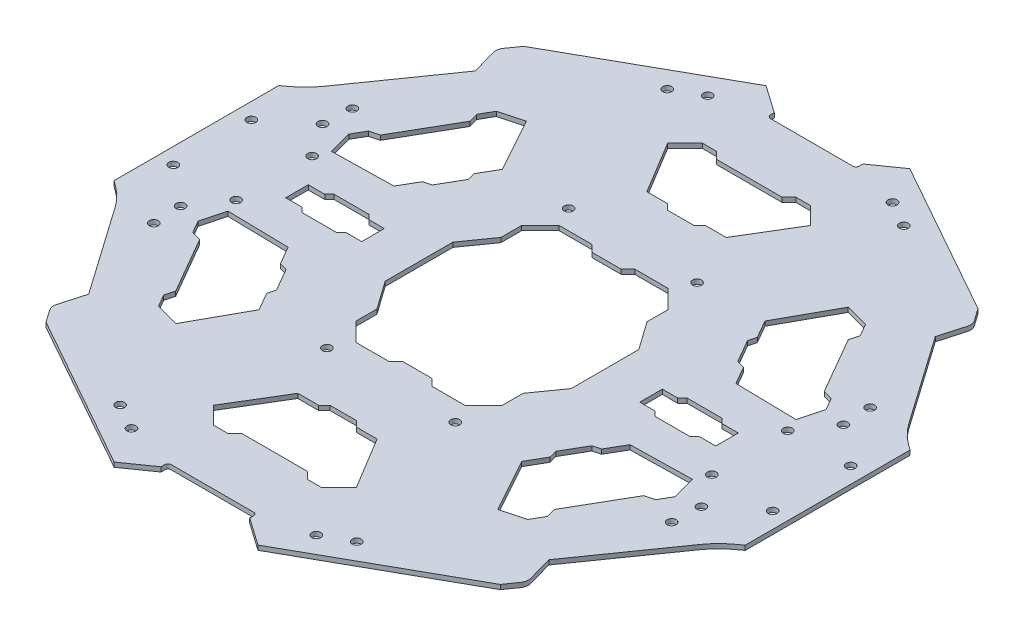
from build123d import *

# Parameters (mm, degrees)
CUT_EXTRUDE1_DEPTH      = 140.098801485
CIRPATTERN1_COUNT       = 6
CUT_EXTRUDE2_DEPTH      = 140.098801485
CUT_EXTRUDE2_DEPTH_BACK = 140.098801485
SKETCH5_R               = 1.37451171
CUT_EXTRUDE3_DEPTH      = 140.098801485
SKETCH4_R               = 1.37451171
CUT_EXTRUDE4_DEPTH      = 140.098801485
SKETCH7_R               = 1.37451171
CUT_EXTRUDE5_DEPTH      = 140.098801485
SKETCH8_R               = 1.37451171
CUT_EXTRUDE6_DEPTH      = 140.098801485
SKETCH9_R               = 1.37451171
CUT_EXTRUDE7_DEPTH      = 140.098801485
SKETCH10_R              = 1.374511707
CUT_EXTRUDE8_DEPTH      = 140.098801485
CUT_EXTRUDE9_DEPTH      = 140.098801485
SKETCH11_R              = 1.37451171
CUT_EXTRUDE10_DEPTH     = 140.098801485
MIRROR3_COPY_1_SKETCH_R = 1.37451171
MIRROR3_COPY_1_DEPTH    = 140.098801485
MIRROR3_COPY_2_SKETCH_R = 1.37451171
MIRROR3_COPY_2_DEPTH    = 140.098801485
MIRROR3_COPY_3_SKETCH_R = 1.37451171
MIRROR3_COPY_3_DEPTH    = 140.098801485
MIRROR3_COPY_4_SKETCH_R = 1.37451171
MIRROR3_COPY_4_DEPTH    = 140.098801485
MIRROR3_COPY_5_SKETCH_R = 1.37451171
MIRROR3_COPY_5_DEPTH    = 140.098801485
MIRROR3_COPY_6_SKETCH_R = 1.374511707
MIRROR3_COPY_6_DEPTH    = 140.098801485
MIRROR3_COPY_7_SKETCH_R = 1.37451171
MIRROR3_COPY_7_DEPTH    = 140.098801485


with BuildPart() as part:
    # Sketch13 for Loft1 → Loft1 section 0
    with BuildSketch(Plane(origin=(0, 1.4, 0), x_dir=(1, 0, 0), z_dir=(0, 1, 0))):
        with BuildLine():
            Line((12.599851657, 91.857709774), (-12.599851657, 91.857709774))
            # circular arc as an exact rational Bezier (weights 1, cos(half-angle), 1)
            Bezier((-12.599851657, 91.857709774), (-13.599851657, 91.857709774), (-13.599851657, 92.857709774), weights=[1, 0.707106781, 1])
            Line((-13.599851657, 92.857709774), (-13.599851657, 93.998402185))
            Line((-13.599851657, 93.998402185), (-22.036698219, 99.916787086))
            Line((-22.036698219, 99.916787086), (-69.635623594, 73.22109349))
            Line((-69.635623594, 73.22109349), (-72.26426252, 69.473884808))
            Bezier((-72.26426252, 69.473884808), (-73.083449495, 68.306107631), (-72.694781967, 66.933625067), weights=[1, 0.903107805, 1])
            Line((-72.694781967, 66.933625067), (-70.517085175, 59.243631276))
            Line((-70.517085175, 59.243631276), (-89.654844676, 31.962144329))
            Bezier((-89.654844676, 31.962144329), (-91.865667397, 28.810545981), (-94.982261121, 26.550644917), weights=[1, 0.986279769, 1])
            Line((-94.982261121, 26.550644917), (-96.763382502, 25.259120111))
            Line((-96.763382502, 25.259120111), (-96.763382502, -25.259120111))
            Line((-96.763382502, -25.259120111), (-94.982261121, -26.550644917))
            Bezier((-94.982261121, -26.550644917), (-91.865667397, -28.810545981), (-89.654844676, -31.962144329), weights=[1, 0.986279769, 1])
            Line((-89.654844676, -31.962144329), (-70.517085175, -59.243631276))
            Line((-70.517085175, -59.243631276), (-72.694781967, -66.933625067))
            Bezier((-72.694781967, -66.933625067), (-73.083449495, -68.306107631), (-72.26426252, -69.473884808), weights=[1, 0.903107805, 1])
            Line((-72.26426252, -69.473884808), (-69.635623594, -73.22109349))
            Line((-69.635623594, -73.22109349), (-22.036698219, -99.916787086))
            Line((-22.036698219, -99.916787086), (-13.599851657, -93.998402185))
            Line((-13.599851657, -93.998402185), (-13.599851657, -92.857709774))
            Bezier((-13.599851657, -92.857709774), (-13.599851657, -91.857709774), (-12.599851657, -91.857709774), weights=[1, 0.707106781, 1])
            Line((-12.599851657, -91.857709774), (12.599851657, -91.857709774))
            Bezier((12.599851657, -91.857709774), (13.599851657, -91.857709774), (13.599851657, -92.857709774), weights=[1, 0.707106781, 1])
            Line((13.599851657, -92.857709774), (13.599851657, -93.998402185))
            Line((13.599851657, -93.998402185), (22.036698219, -99.916787086))
            Line((22.036698219, -99.916787086), (69.635623594, -73.22109349))
            Line((69.635623594, -73.22109349), (72.26426252, -69.473884808))
            Bezier((72.26426252, -69.473884808), (73.083449495, -68.306107631), (72.694781967, -66.933625067), weights=[1, 0.903107805, 1])
            Line((72.694781967, -66.933625067), (70.517085175, -59.243631276))
            Line((70.517085175, -59.243631276), (89.654844676, -31.962144329))
            Bezier((89.654844676, -31.962144329), (91.865667397, -28.810545981), (94.982261121, -26.550644917), weights=[1, 0.986279769, 1])
            Line((94.982261121, -26.550644917), (96.763382502, -25.259120111))
            Line((96.763382502, -25.259120111), (96.763382502, 25.259120111))
            Line((96.763382502, 25.259120111), (94.982261121, 26.550644917))
            Bezier((94.982261121, 26.550644917), (91.865667397, 28.810545981), (89.654844676, 31.962144329), weights=[1, 0.986279769, 1])
            Line((89.654844676, 31.962144329), (70.517085175, 59.243631276))
            Line((70.517085175, 59.243631276), (72.694781967, 66.933625067))
            Bezier((72.694781967, 66.933625067), (73.083449495, 68.306107631), (72.26426252, 69.473884808), weights=[1, 0.903107805, 1])
            Line((72.26426252, 69.473884808), (69.635623594, 73.22109349))
            Line((69.635623594, 73.22109349), (22.036698219, 99.916787086))
            Line((22.036698219, 99.916787086), (13.599851657, 93.998402185))
            Line((13.599851657, 93.998402185), (13.599851657, 92.857709774))
            Bezier((13.599851657, 92.857709774), (13.599851657, 91.857709774), (12.599851657, 91.857709774), weights=[1, 0.707106781, 1])
        make_face()
    # Sketch2 for Loft1 → Loft1 section 1
    with BuildSketch(Plane(origin=(0, 0, 0), x_dir=(1, 0, 0), z_dir=(0, 1, 0))):
        with BuildLine():
            Line((12.599851657, 91.857709774), (-12.599851657, 91.857709774))
            Bezier((-12.599851657, 91.857709774), (-13.599851657, 91.857709774), (-13.599851657, 92.857709774), weights=[1, 0.707106781, 1])
            Line((-13.599851657, 92.857709774), (-13.599851657, 93.998402185))
            Line((-13.599851657, 93.998402185), (-22.036698219, 99.916787086))
            Line((-22.036698219, 99.916787086), (-69.635623594, 73.22109349))
            Line((-69.635623594, 73.22109349), (-72.26426252, 69.473884808))
            Bezier((-72.26426252, 69.473884808), (-73.083449495, 68.306107631), (-72.694781967, 66.933625067), weights=[1, 0.903107805, 1])
            Line((-72.694781967, 66.933625067), (-70.517085175, 59.243631276))
            Line((-70.517085175, 59.243631276), (-89.654844676, 31.962144329))
            Bezier((-89.654844676, 31.962144329), (-91.865667397, 28.810545981), (-94.982261121, 26.550644917), weights=[1, 0.986279769, 1])
            Line((-94.982261121, 26.550644917), (-96.763382502, 25.259120111))
            Line((-96.763382502, 25.259120111), (-96.763382502, -25.259120111))
            Line((-96.763382502, -25.259120111), (-94.982261121, -26.550644917))
            Bezier((-94.982261121, -26.550644917), (-91.865667397, -28.810545981), (-89.654844676, -31.962144329), weights=[1, 0.986279769, 1])
            Line((-89.654844676, -31.962144329), (-70.517085175, -59.243631276))
            Line((-70.517085175, -59.243631276), (-72.694781967, -66.933625067))
            Bezier((-72.694781967, -66.933625067), (-73.083449495, -68.306107631), (-72.26426252, -69.473884808), weights=[1, 0.903107805, 1])
            Line((-72.26426252, -69.473884808), (-69.635623594, -73.22109349))
            Line((-69.635623594, -73.22109349), (-22.036698219, -99.916787086))
            Line((-22.036698219, -99.916787086), (-13.599851657, -93.998402185))
            Line((-13.599851657, -93.998402185), (-13.599851657, -92.857709774))
            Bezier((-13.599851657, -92.857709774), (-13.599851657, -91.857709774), (-12.599851657, -91.857709774), weights=[1, 0.707106781, 1])
            Line((-12.599851657, -91.857709774), (12.599851657, -91.857709774))
            Bezier((12.599851657, -91.857709774), (13.599851657, -91.857709774), (13.599851657, -92.857709774), weights=[1, 0.707106781, 1])
            Line((13.599851657, -92.857709774), (13.599851657, -93.998402185))
            Line((13.599851657, -93.998402185), (22.036698219, -99.916787086))
            Line((22.036698219, -99.916787086), (69.635623594, -73.22109349))
            Line((69.635623594, -73.22109349), (72.26426252, -69.473884808))
            Bezier((72.26426252, -69.473884808), (73.083449495, -68.306107631), (72.694781967, -66.933625067), weights=[1, 0.903107805, 1])
            Line((72.694781967, -66.933625067), (70.517085175, -59.243631276))
            Line((70.517085175, -59.243631276), (89.654844676, -31.962144329))
            Bezier((89.654844676, -31.962144329), (91.865667397, -28.810545981), (94.982261121, -26.550644917), weights=[1, 0.986279769, 1])
            Line((94.982261121, -26.550644917), (96.763382502, -25.259120111))
            Line((96.763382502, -25.259120111), (96.763382502, 25.259120111))
            Line((96.763382502, 25.259120111), (94.982261121, 26.550644917))
            Bezier((94.982261121, 26.550644917), (91.865667397, 28.810545981), (89.654844676, 31.962144329), weights=[1, 0.986279769, 1])
            Line((89.654844676, 31.962144329), (70.517085175, 59.243631276))
            Line((70.517085175, 59.243631276), (72.694781967, 66.933625067))
            Bezier((72.694781967, 66.933625067), (73.083449495, 68.306107631), (72.26426252, 69.473884808), weights=[1, 0.903107805, 1])
            Line((72.26426252, 69.473884808), (69.635623594, 73.22109349))
            Line((69.635623594, 73.22109349), (22.036698219, 99.916787086))
            Line((22.036698219, 99.916787086), (13.599851657, 93.998402185))
            Line((13.599851657, 93.998402185), (13.599851657, 92.857709774))
            Bezier((13.599851657, 92.857709774), (13.599851657, 91.857709774), (12.599851657, 91.857709774), weights=[1, 0.707106781, 1])
        make_face()
    loft()

    # Sketch3 → Cut-Extrude1 (cut, symmetric)
    with BuildSketch(Plane(origin=(0, 0, 0), x_dir=(1, 0, 0), z_dir=(0, 1, 0))):
        Polygon((5.778306851, 53.506873502), (4.033589436, 51.762156087), (-4.033589436, 51.762156087), (-5.778306851, 53.506873502), (-12.15031828, 53.506873502), (-21.860049982, 69.588616633), (-16.550040457, 74.898626157), (-12.15031828, 74.898626157), (-10.026314471, 72.774622347), (10.026314471, 72.774622347), (12.15031828, 74.898626157), (16.550040457, 74.898626157), (21.860049982, 69.588616633), (12.15031828, 53.506873502), align=None)
    cut_extrude1 = extrude(amount=CUT_EXTRUDE1_DEPTH, both=True, mode=Mode.SUBTRACT)

    # CirPattern1: Cut-Extrude1 ×6 about axis
    cirpattern1_axis = Axis((0, 0, 0), (0, 1, 0))
    for i in range(1, CIRPATTERN1_COUNT):
        add(cut_extrude1.rotate(cirpattern1_axis, i * 360 / CIRPATTERN1_COUNT), mode=Mode.SUBTRACT)

    # Sketch1 → Cut-Extrude2 (cut, two sides: drawn at the far end of the back side and taken through both)
    with BuildSketch(Plane(origin=(0, 0, 0), x_dir=(1, 0, 0), z_dir=(0, 1, 0)).offset(-CUT_EXTRUDE2_DEPTH_BACK)):
        Polygon((-4.440479391, 29.001763017), (-6.538699097, 31.099982724), (-16.659523563, 31.099982724), (-22.398771583, 25.360734704), (-22.398771583, 19.00436324), (-28.508293669, 10.364635038), (-28.508293669, -10.364635038), (-22.398771583, -19.00436324), (-22.398771583, -25.360734704), (-16.659523563, -31.099982724), (-6.538699097, -31.099982724), (-4.440479391, -29.001763017), (4.440479391, -29.001763017), (6.538699097, -31.099982724), (16.659523563, -31.099982724), (22.398771583, -25.360734704), (22.398771583, -19.00436324), (28.508293669, -10.364635038), (28.508293669, 10.364635038), (22.398771583, 19.00436324), (22.398771583, 25.360734704), (16.659523563, 31.099982724), (6.538699097, 31.099982724), (4.440479391, 29.001763017), align=None)
    extrude(amount=CUT_EXTRUDE2_DEPTH + CUT_EXTRUDE2_DEPTH_BACK, mode=Mode.SUBTRACT)

    # Sketch5 → Cut-Extrude3 (cut, symmetric)
    with BuildSketch(Plane(origin=(0, 0, 0), x_dir=(1, 0, 0), z_dir=(0, 1, 0))):
        with Locations(Location((-28.336633114, 88.320069792, 0), (0, 0, 90))):
            Circle(SKETCH5_R)
    cut_extrude3 = extrude(amount=CUT_EXTRUDE3_DEPTH, both=True, mode=Mode.SUBTRACT)

    # Sketch4 → Cut-Extrude4 (cut, symmetric)
    with BuildSketch(Plane(origin=(0, 0, 0), x_dir=(1, 0, 0), z_dir=(0, 1, 0))):
        with Locations(Location((-36.2675368, 83.858936469, 0), (0, 0, 90))):
            Circle(SKETCH4_R)
    cut_extrude4 = extrude(amount=CUT_EXTRUDE4_DEPTH, both=True, mode=Mode.SUBTRACT)

    # Sketch7 → Cut-Extrude5 (cut, symmetric)
    with BuildSketch(Plane(origin=(0, 0, 0), x_dir=(1, 0, 0), z_dir=(0, 1, 0))):
        with Locations(Location((-79.3711144, 30.432855804, 0), (0, 0, 90))):
            Circle(SKETCH7_R)
    cut_extrude5 = extrude(amount=CUT_EXTRUDE5_DEPTH, both=True, mode=Mode.SUBTRACT)

    # Sketch8 → Cut-Extrude6 (cut, symmetric)
    with BuildSketch(Plane(origin=(0, 0, 0), x_dir=(1, 0, 0), z_dir=(0, 1, 0))):
        with Locations(Location((-79.839748009, 21.76313405, 0), (0, 0, 90))):
            Circle(SKETCH8_R)
    cut_extrude6 = extrude(amount=CUT_EXTRUDE6_DEPTH, both=True, mode=Mode.SUBTRACT)

    # Sketch9 → Cut-Extrude7 (cut, symmetric)
    with BuildSketch(Plane(origin=(0, 0, 0), x_dir=(1, 0, 0), z_dir=(0, 1, 0))):
        with Locations(Location((-91.857533529, 11.956002303, 0), (0, 0, 90))):
            Circle(SKETCH9_R)
    cut_extrude7 = extrude(amount=CUT_EXTRUDE7_DEPTH, both=True, mode=Mode.SUBTRACT)

    # Sketch10 → Cut-Extrude8 (cut, symmetric)
    with BuildSketch(Plane(origin=(0, 0, 0), x_dir=(1, 0, 0), z_dir=(0, 1, 0))):
        with Locations(Location((-72.917085316, 11.644715299, 0), (0, 0, 90))):
            Circle(SKETCH10_R)
    cut_extrude8 = extrude(amount=CUT_EXTRUDE8_DEPTH, both=True, mode=Mode.SUBTRACT)

    # Sketch12 → Cut-Extrude9 (cut, symmetric)
    with BuildSketch(Plane(origin=(0, 0, 0), x_dir=(1, 0, 0), z_dir=(0, 1, 0))):
        Polygon((-42.618232688, -3.460198418), (-42.618232688, 3.460198418), (-47.342708161, 3.460198418), (-48.771037956, 4.888528212), (-59.428575651, 4.888528212), (-60.856905445, 3.460198418), (-65.910995486, 3.460198418), (-65.910995486, -3.460198418), (-60.856905445, -3.460198418), (-59.428575651, -4.888528212), (-48.771037956, -4.888528212), (-47.342708161, -3.460198418), align=None)
    cut_extrude9 = extrude(amount=CUT_EXTRUDE9_DEPTH, both=True, mode=Mode.SUBTRACT)

    # Sketch11 → Cut-Extrude10 (cut, symmetric)
    with BuildSketch(Plane(origin=(0, 0, 0), x_dir=(1, 0, 0), z_dir=(0, 1, 0))):
        with Locations(Location((-19.682934717, 37.057699858, 0), (0, 0, 90))):
            Circle(SKETCH11_R)
    cut_extrude10 = extrude(amount=CUT_EXTRUDE10_DEPTH, both=True, mode=Mode.SUBTRACT)

    # Mirror1: Cut-Extrude9 across plane
    add(cut_extrude9.mirror(Plane(origin=(0, 0, 0), x_dir=(0, 0, 1), z_dir=(1, 0, 0))), mode=Mode.SUBTRACT)

    # Mirror2: Cut-Extrude3, Cut-Extrude4, Cut-Extrude5, Cut-Extrude6, Cut-Extrude7, Cut-Extrude8, Cut-Extrude10 across plane
    add(cut_extrude3.mirror(Plane(origin=(0, 0, 0), x_dir=(0, 0, 1), z_dir=(1, 0, 0))), mode=Mode.SUBTRACT)
    add(cut_extrude4.mirror(Plane(origin=(0, 0, 0), x_dir=(0, 0, 1), z_dir=(1, 0, 0))), mode=Mode.SUBTRACT)
    add(cut_extrude5.mirror(Plane(origin=(0, 0, 0), x_dir=(0, 0, 1), z_dir=(1, 0, 0))), mode=Mode.SUBTRACT)
    add(cut_extrude6.mirror(Plane(origin=(0, 0, 0), x_dir=(0, 0, 1), z_dir=(1, 0, 0))), mode=Mode.SUBTRACT)
    add(cut_extrude7.mirror(Plane(origin=(0, 0, 0), x_dir=(0, 0, 1), z_dir=(1, 0, 0))), mode=Mode.SUBTRACT)
    add(cut_extrude8.mirror(Plane(origin=(0, 0, 0), x_dir=(0, 0, 1), z_dir=(1, 0, 0))), mode=Mode.SUBTRACT)
    add(cut_extrude10.mirror(Plane(origin=(0, 0, 0), x_dir=(0, 0, 1), z_dir=(1, 0, 0))), mode=Mode.SUBTRACT)

    # Mirror3: Cut-Extrude3, Cut-Extrude4, Cut-Extrude5, Cut-Extrude6, Cut-Extrude7, Cut-Extrude8, Cut-Extrude10 across plane
    add(cut_extrude3.mirror(Plane.XY), mode=Mode.SUBTRACT)
    add(cut_extrude4.mirror(Plane.XY), mode=Mode.SUBTRACT)
    add(cut_extrude5.mirror(Plane.XY), mode=Mode.SUBTRACT)
    add(cut_extrude6.mirror(Plane.XY), mode=Mode.SUBTRACT)
    add(cut_extrude7.mirror(Plane.XY), mode=Mode.SUBTRACT)
    add(cut_extrude8.mirror(Plane.XY), mode=Mode.SUBTRACT)
    add(cut_extrude10.mirror(Plane.XY), mode=Mode.SUBTRACT)

    # Mirror3 copy 1 sketch → Mirror3 copy 1 (cut, symmetric)
    with BuildSketch(Plane(origin=(0, 0, 0), x_dir=(-1, 0, 0), z_dir=(0, 1, 0))):
        with Locations(Location((-28.336633114, 88.320069792, 0), (0, 0, 90))):
            Circle(MIRROR3_COPY_1_SKETCH_R)
    extrude(amount=MIRROR3_COPY_1_DEPTH, both=True, mode=Mode.SUBTRACT)

    # Mirror3 copy 2 sketch → Mirror3 copy 2 (cut, symmetric)
    with BuildSketch(Plane(origin=(0, 0, 0), x_dir=(-1, 0, 0), z_dir=(0, 1, 0))):
        with Locations(Location((-36.2675368, 83.858936469, 0), (0, 0, 90))):
            Circle(MIRROR3_COPY_2_SKETCH_R)
    extrude(amount=MIRROR3_COPY_2_DEPTH, both=True, mode=Mode.SUBTRACT)

    # Mirror3 copy 3 sketch → Mirror3 copy 3 (cut, symmetric)
    with BuildSketch(Plane(origin=(0, 0, 0), x_dir=(-1, 0, 0), z_dir=(0, 1, 0))):
        with Locations(Location((-79.3711144, 30.432855804, 0), (0, 0, 90))):
            Circle(MIRROR3_COPY_3_SKETCH_R)
    extrude(amount=MIRROR3_COPY_3_DEPTH, both=True, mode=Mode.SUBTRACT)

    # Mirror3 copy 4 sketch → Mirror3 copy 4 (cut, symmetric)
    with BuildSketch(Plane(origin=(0, 0, 0), x_dir=(-1, 0, 0), z_dir=(0, 1, 0))):
        with Locations(Location((-79.839748009, 21.76313405, 0), (0, 0, 90))):
            Circle(MIRROR3_COPY_4_SKETCH_R)
    extrude(amount=MIRROR3_COPY_4_DEPTH, both=True, mode=Mode.SUBTRACT)

    # Mirror3 copy 5 sketch → Mirror3 copy 5 (cut, symmetric)
    with BuildSketch(Plane(origin=(0, 0, 0), x_dir=(-1, 0, 0), z_dir=(0, 1, 0))):
        with Locations(Location((-91.857533529, 11.956002303, 0), (0, 0, 90))):
            Circle(MIRROR3_COPY_5_SKETCH_R)
    extrude(amount=MIRROR3_COPY_5_DEPTH, both=True, mode=Mode.SUBTRACT)

    # Mirror3 copy 6 sketch → Mirror3 copy 6 (cut, symmetric)
    with BuildSketch(Plane(origin=(0, 0, 0), x_dir=(-1, 0, 0), z_dir=(0, 1, 0))):
        with Locations(Location((-72.917085316, 11.644715299, 0), (0, 0, 90))):
            Circle(MIRROR3_COPY_6_SKETCH_R)
    extrude(amount=MIRROR3_COPY_6_DEPTH, both=True, mode=Mode.SUBTRACT)

    # Mirror3 copy 7 sketch → Mirror3 copy 7 (cut, symmetric)
    with BuildSketch(Plane(origin=(0, 0, 0), x_dir=(-1, 0, 0), z_dir=(0, 1, 0))):
        with Locations(Location((-19.682934717, 37.057699858, 0), (0, 0, 90))):
            Circle(MIRROR3_COPY_7_SKETCH_R)
    extrude(amount=MIRROR3_COPY_7_DEPTH, both=True, mode=Mode.SUBTRACT)


solid = part.part
